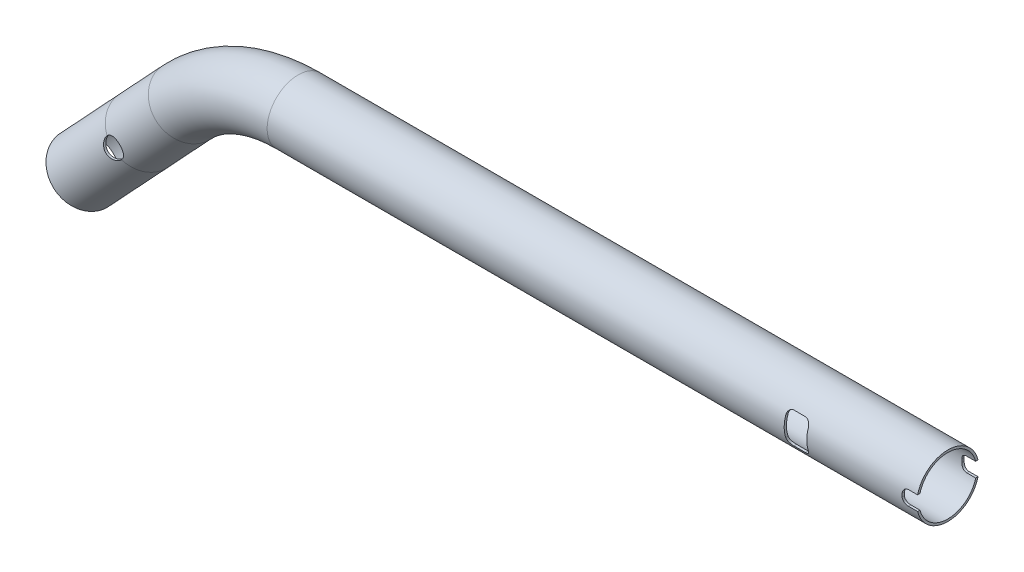
from build123d import *

# Parameters (mm, degrees)
SKETCH3_R               = 11
SKETCH3_R_2             = 10.2
CUT_EXTRUDE1_REACH      = 190.778
SKETCH4_R               = 3.5
SKETCH5_R               = 3.3
CUT_EXTRUDE2_DEPTH      = 189.777977341
CUT_EXTRUDE3_DEPTH      = 189.777977341
CUT_EXTRUDE3_DEPTH_BACK = 189.777977341


with BuildPart() as part:
    # Sweep2: sweep along a path in Sketch1
    with BuildLine(Plane.XY) as sweep2_path:
        Line((136.626450457, 0), (93.626450457, 0))
        Line((93.626450457, 0), (-93.626450457, 0))
        ThreePointArc((-93.626450457, 0), (-115.158900179, -4.478755983), (-133.119550344, -17.172088557))
        Line((-133.119550344, -17.172088557), (-148.373549543, -33.53))
        Line((-148.373549543, -33.53), (-169.373549543, -56.049742911))
    # Sketch3 → Sweep2 (sweep)
    with BuildSketch(Plane(origin=(93.626450457, 0, 0), x_dir=(0, 0, -1), z_dir=(1, 0, 0))):
        Circle(SKETCH3_R)
        Circle(SKETCH3_R_2, mode=Mode.SUBTRACT)
    sweep(path=sweep2_path.line)

    # Sketch4 → Cut-Extrude1 (cut, up to next)
    with BuildSketch(Plane.XY, mode=Mode.PRIVATE) as cut_extrude1_sk1:
        with Locations((-148.373549543, -33.53)):
            Circle(SKETCH4_R)
    cut_extrude1_tool1 = extrude(cut_extrude1_sk1.sketch, amount=CUT_EXTRUDE1_REACH, mode=Mode.PRIVATE) & part.part
    # Sketch4 → Cut-Extrude1 (cut, up to next)
    with BuildSketch(Plane.XY, mode=Mode.PRIVATE) as cut_extrude1_sk2:
        with BuildLine():
            Line((91.626450457, -5.5), (95.626450457, -5.5))
            ThreePointArc((95.626450457, -5.5), (97.040664019, -4.914213562), (97.626450457, -3.5))
            Line((97.626450457, -3.5), (97.626450457, 3.5))
            ThreePointArc((97.626450457, 3.5), (97.040664019, 4.914213562), (95.626450457, 5.5))
            Line((95.626450457, 5.5), (91.626450457, 5.5))
            ThreePointArc((91.626450457, 5.5), (90.212236895, 4.914213562), (89.626450457, 3.5))
            Line((89.626450457, 3.5), (89.626450457, -3.5))
            ThreePointArc((89.626450457, -3.5), (90.212236895, -4.914213562), (91.626450457, -5.5))
        make_face()
    cut_extrude1_tool2 = extrude(cut_extrude1_sk2.sketch, amount=CUT_EXTRUDE1_REACH, mode=Mode.PRIVATE) & part.part
    add(cut_extrude1_tool1.solids().sort_by_distance((-148.37355, -33.53, 0))[0], mode=Mode.SUBTRACT)
    add(cut_extrude1_tool2.solids().sort_by_distance((93.62645, 0, 0))[0], mode=Mode.SUBTRACT)

    # Sketch5 → Cut-Extrude2 (cut, through all)
    with BuildSketch(Plane.XY):
        with Locations((-148.373549543, -33.53)):
            Circle(SKETCH5_R)
    extrude(amount=-CUT_EXTRUDE2_DEPTH, mode=Mode.SUBTRACT)

    # Sketch6 → Cut-Extrude3 (cut, two sides: drawn at the far end of the back side and taken through both)
    with BuildSketch(Plane.XY.offset(-CUT_EXTRUDE3_DEPTH_BACK)):
        with BuildLine():
            Line((136.700236513, 2.554733627), (136.626450457, -2.554733627))
            Line((136.626450457, -2.554733627), (133.426450457, -2.554733627))
            ThreePointArc((133.426450457, -2.554733627), (132.012236895, -1.968947189), (131.426450457, -0.554733627))
            Line((131.426450457, -0.554733627), (131.426450457, 0.554733627))
            ThreePointArc((131.426450457, 0.554733627), (132.012236895, 1.968947189), (133.426450457, 2.554733627))
            Line((133.426450457, 2.554733627), (136.700236513, 2.554733627))
        make_face()
    extrude(amount=CUT_EXTRUDE3_DEPTH + CUT_EXTRUDE3_DEPTH_BACK, mode=Mode.SUBTRACT)


solid = part.part
